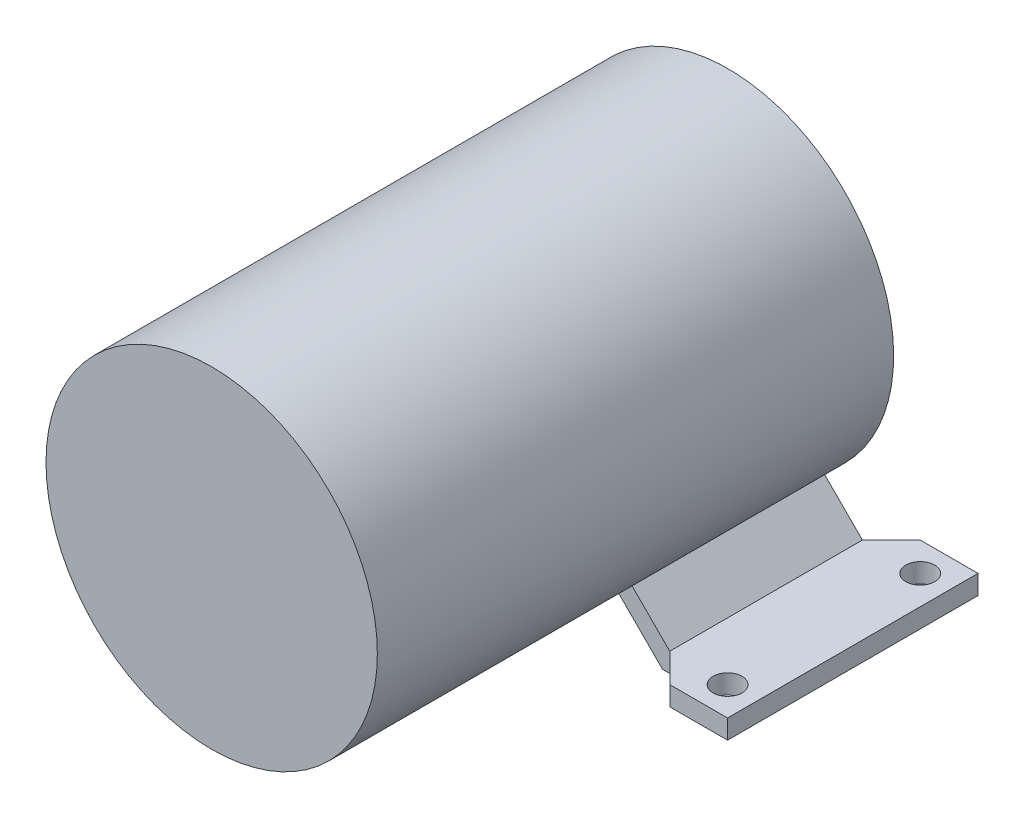
from build123d import *

# Parameters (mm, degrees)
SKETCH1_R           = 54.61
BOSS_EXTRUDE1_DEPTH = 170.18
BOSS_EXTRUDE2_START = -170.18
SKETCH2_R           = 6.35
BOSS_EXTRUDE2_DEPTH = 25.4
BOSS_EXTRUDE3_DEPTH = 63.5
SKETCH4_R           = 4.7625
SKETCH4_W           = 3.175
SKETCH4_H           = 63.5
BOSS_EXTRUDE4_DEPTH = 6.35


with BuildPart() as part:
    # Sketch1 → Boss-Extrude1 (new body)
    with BuildSketch(Plane.XY):
        Circle(SKETCH1_R)
    extrude(amount=BOSS_EXTRUDE1_DEPTH)

    # Sketch2 → Boss-Extrude2 (add)
    with BuildSketch(Plane.XY.offset(170.18).offset(BOSS_EXTRUDE2_START)):
        Circle(SKETCH2_R)
    extrude(amount=-BOSS_EXTRUDE2_DEPTH)

    # Sketch3 → Boss-Extrude3 (add)
    with BuildSketch(Plane.XY):
        with BuildLine():
            Line((-31.288001325, -44.758385506), (-44.314615818, -57.785))
            Line((-44.314615818, -57.785), (-47.489615818, -57.785))
            Line((-47.489615818, -57.785), (-47.489615818, -64.135))
            Line((-47.489615818, -64.135), (-41.928035591, -64.135))
            Line((-41.928035591, -64.135), (-25.880821668, -48.087786077))
            ThreePointArc((-25.880821668, -48.087786077), (-28.63284491, -46.501745047), (-31.288001325, -44.758385506))
        make_face()
    extrude(amount=BOSS_EXTRUDE3_DEPTH)

    # Sketch4 → Boss-Extrude4 (add)
    # profile 1 of 2: a face of its own
    with BuildSketch(Plane(origin=(0, -57.785, 0), x_dir=(1, 0, 0), z_dir=(0, 1, 0))):
        Polygon((-72.889615818, -73.025), (-53.839615818, -73.025), (-44.314615818, -63.5), (-47.489615818, -63.5), (-47.489615818, 0), (-44.314615818, 0), (-53.839615818, 9.525), (-72.889615818, 9.525), align=None)
        with Locations(Location((-63.364615818, -63.5, 0), (0, 0, 180))):
            Circle(SKETCH4_R, mode=Mode.SUBTRACT)
        with Locations(Location((-63.364615818, 0, 0), (0, 0, 180))):
            Circle(SKETCH4_R, mode=Mode.SUBTRACT)
    # profile 2 of 2: a face of its own
    with BuildSketch(Plane(origin=(0, -57.785, 0), x_dir=(1, 0, 0), z_dir=(0, 1, 0))):
        with Locations((-45.902115818, -31.75)):
            Rectangle(SKETCH4_W, SKETCH4_H)
    extrude(amount=-BOSS_EXTRUDE4_DEPTH)

    # Mirror1: part across plane


with BuildPart() as part_1:
    add(part.part)
    add(part.part.mirror(Plane(origin=(0, 0, 0), x_dir=(0, 0, 1), z_dir=(1, 0, 0))))


solid = part_1.part
